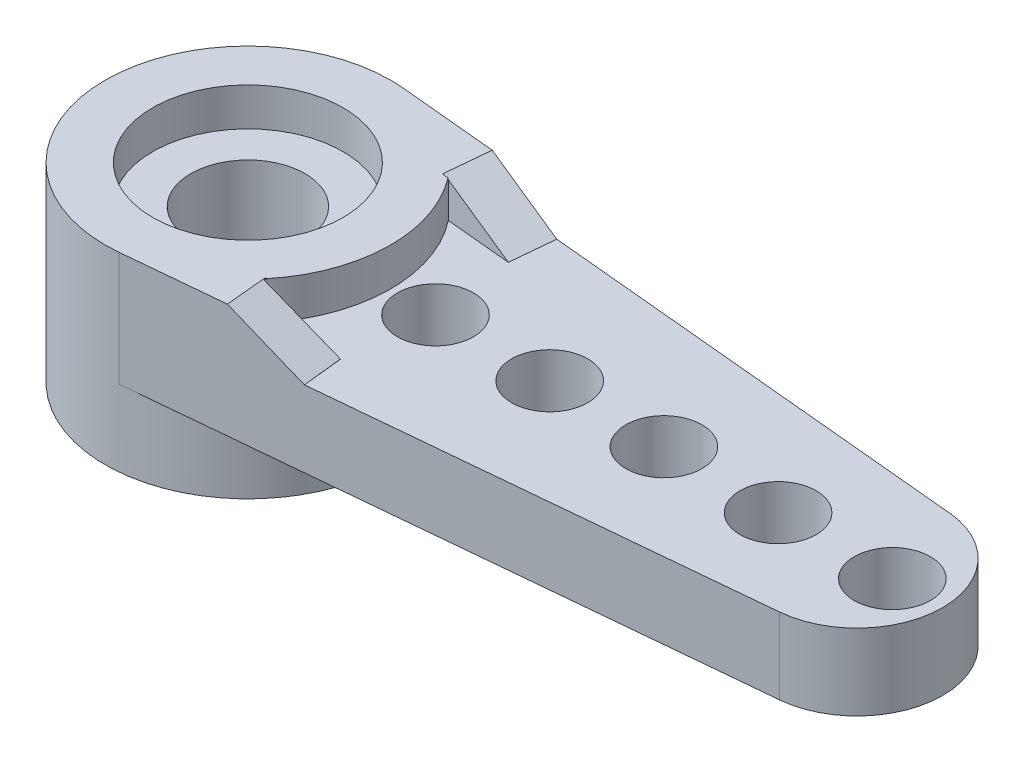
from build123d import *

# Parameters (mm, degrees)
SKETCH_1_R          = 3.75
SKETCH_1_R_2        = 2.25
EXTRUDE_1_DEPTH     = 2
SKETCH_2_R          = 3.75
SKETCH_2_R_2        = 2.5
EXTRUDE_2_DEPTH     = 1
EXTRUDE_START       = 2
SKETCH_3_R          = 3.75
SKETCH_3_R_2        = 2.5
EXTRUDE_3_DEPTH     = 2
SKETCH_4_R          = 1.5
SKETCH_4_R_2        = 1
CUT_EXTRUDE_1_DEPTH = 2
EXTRUDE_4_DEPTH     = 1
CUT_EXTRUDE_2_DEPTH = 1.1
CUT_EXTRUDE_4_DEPTH = 1.2


with BuildPart() as part:
    # 草图1 → 凸台-拉伸1 (new body)
    with BuildSketch(Plane(origin=(0, 0, 0), x_dir=(1, 0, 0), z_dir=(0, 1, 0))):
        Circle(SKETCH_1_R)
        with BuildLine():
            Line((16.2109375, 2.240090483), (0.3515625, 3.733484138))
            ThreePointArc((0.3515625, 3.733484138), (2.773162398, 2.524296003), (3.75, 0))
            ThreePointArc((3.75, 0), (2.773162398, -2.524296003), (0.3515625, -3.733484138))
            Line((0.3515625, -3.733484138), (16.2109375, -2.240090483))
            ThreePointArc((16.2109375, -2.240090483), (13.75, 0), (16.2109375, 2.240090483))
        make_face()
        with Locations((16, 0)):
            Circle(SKETCH_1_R_2)
    extrude(amount=EXTRUDE_1_DEPTH)

    # 草图2 → 凸台-拉伸2 (add)
    with BuildSketch(Plane(origin=(0, 2, 0), x_dir=(1, 0, 0), z_dir=(0, 1, 0))):
        with Locations(Location((0, 0, 0), (0, 0, 84.620621009))):
            Circle(SKETCH_2_R)
        with Locations(Location((0, 0, 0), (0, 0, 270))):
            Circle(SKETCH_2_R_2, mode=Mode.SUBTRACT)
    extrude(amount=EXTRUDE_2_DEPTH)

    # 草图3 → 凸台-拉伸3 (add)
    with BuildSketch(Plane.XZ.offset(EXTRUDE_START)):
        with Locations(Location((0, 0, 0), (0, 0, 270))):
            Circle(SKETCH_3_R)
        with Locations(Location((0, 0, 0), (0, 0, 90))):
            Circle(SKETCH_3_R_2, mode=Mode.SUBTRACT)
    extrude(amount=-EXTRUDE_3_DEPTH)

    # 草图4 → 切除-拉伸1 (cut)
    with BuildSketch(Plane(origin=(0, 2, 0), x_dir=(1, 0, 0), z_dir=(0, 1, 0))):
        with Locations(Location((0, 0, 0), (0, 0, 270))):
            Circle(SKETCH_4_R)
        with Locations(Location((4.92748738, 0, 0), (0, 0, 270))):
            Circle(SKETCH_4_R_2)
        with Locations(Location((7.92748738, 0, 0), (0, 0, 270))):
            Circle(SKETCH_4_R_2)
        with Locations(Location((10.92748738, 0, 0), (0, 0, 270))):
            Circle(SKETCH_4_R_2)
        with Locations(Location((13.92748738, 0, 0), (0, 0, 270))):
            Circle(SKETCH_4_R_2)
        with Locations(Location((16.92748738, 0, 0), (0, 0, 270))):
            Circle(SKETCH_4_R_2)
    extrude(amount=-CUT_EXTRUDE_1_DEPTH, mode=Mode.SUBTRACT)

    # 草图5 → 凸台-拉伸4 (add)
    with BuildSketch(Plane(origin=(0, 2, 0), x_dir=(1, 0, 0), z_dir=(0, 1, 0))):
        with BuildLine():
            Line((0.3515625, 3.733484138), (4.799205036, 3.31467311))
            Line((4.799205036, 3.31467311), (4.689652743, 2.151261914))
            Line((4.689652743, 2.151261914), (2.950077578, 2.315068527))
            ThreePointArc((2.950077578, 2.315068527), (1.796714366, 3.291552444), (0.3515625, 3.733484138))
        make_face()
        with BuildLine():
            Line((0.3515625, -3.733484138), (4.799205036, -3.31467311))
            Line((4.799205036, -3.31467311), (4.689652743, -2.258798299))
            Line((4.689652743, -2.258798299), (2.838244627, -2.450891151))
            ThreePointArc((2.838244627, -2.450891151), (1.71900511, -3.332794838), (0.3515625, -3.733484138))
        make_face()
    extrude(amount=EXTRUDE_4_DEPTH)

    # 草图6 → 切除-拉伸2 (cut)
    with BuildSketch(Plane(origin=(0.3515625, 0, 3.733484138), x_dir=(0.9955957701296245, 0, -0.09374999999999994), z_dir=(0.09374999999999994, 0, 0.9955957701296245))):
        Polygon((2.610250593, 3), (4.46731763, 2), (4.46731763, 3), align=None)
    extrude(amount=-CUT_EXTRUDE_2_DEPTH, mode=Mode.SUBTRACT)

    # 草图7 → 切除-拉伸4 (cut)
    with BuildSketch(Plane(origin=(0.3515625, 0, -3.733484138), x_dir=(-0.9955957701296245, 0, -0.09375), z_dir=(0.09375, 0, -0.9955957701296245))):
        Polygon((-2.586419937, 3), (-4.46731763, 2), (-4.46731763, 3), align=None)
    extrude(amount=-CUT_EXTRUDE_4_DEPTH, mode=Mode.SUBTRACT)


solid = part.part
